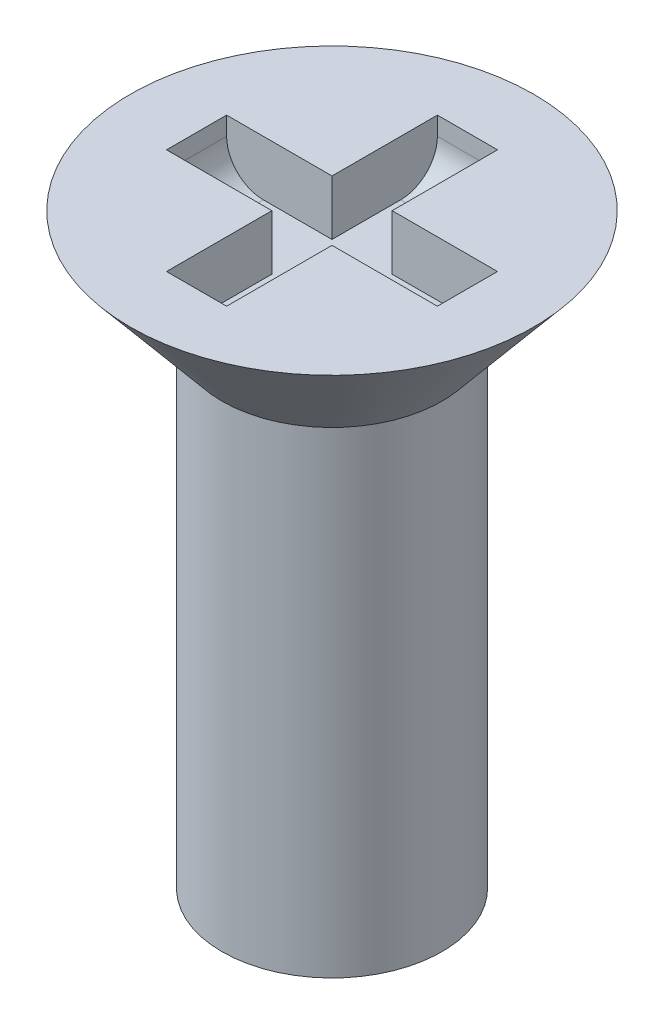
from build123d import *

# Parameters (mm, degrees)
SKETCH1_R           = 3
BOSS_EXTRUDE1_DEPTH = 13
CUT_EXTRUDE1_DEPTH  = 1.5
FILLET1_R           = 1
FILLET2_R           = 1
FILLET3_R           = 1
FILLET4_R           = 1


with BuildPart() as part:
    # Sketch1 → Boss-Extrude1 (new body)
    with BuildSketch(Plane(origin=(0, 0, 0), x_dir=(1, 0, 0), z_dir=(0, 1, 0))):
        with Locations(Location((0, 0, 0), (0, 0, 90))):
            Circle(SKETCH1_R)
    extrude(amount=BOSS_EXTRUDE1_DEPTH)

    # Sketch3 → Revolve2 (revolve)
    with BuildSketch(Plane.XY, mode=Mode.PRIVATE) as revolve2_sk:
        Polygon((0, 13), (0, 16), (-5.5, 16), (-3, 13), align=None)
    revolve(revolve2_sk.sketch.rotate(Axis((0, 13, 0), (0, 1, 0)), 270), axis=Axis((0, 13, 0), (0, 1, 0)))

    # Sketch4 → Cut-Extrude1 (cut)
    with BuildSketch(Plane(origin=(0, 16, 0), x_dir=(1, 0, 0), z_dir=(0, 1, 0))):
        Polygon((-0.819580165, 0.819580165), (-3.693115778, 0.819580165), (-3.693115778, -0.819580165), (-0.819580165, -0.819580165), (-0.819580165, -3.693115778), (0.819580165, -3.693115778), (0.819580165, -0.819580165), (3.693115778, -0.819580165), (3.693115778, 0.819580165), (0.819580165, 0.819580165), (0.819580165, 3.693115778), (-0.819580165, 3.693115778), align=None)
    extrude(amount=-CUT_EXTRUDE1_DEPTH, mode=Mode.SUBTRACT)

    # Fillet1
    fillet1_edges = [part.edges().sort_by_distance(p)[0] for p in [
        (0, 14.5, -3.693115778),
    ]]
    fillet(fillet1_edges, radius=FILLET1_R)

    # Fillet2
    fillet2_edges = [part.edges().sort_by_distance(p)[0] for p in [
        (3.693115778, 14.5, 0),
    ]]
    fillet(fillet2_edges, radius=FILLET2_R)

    # Fillet3
    fillet3_edges = [part.edges().sort_by_distance(p)[0] for p in [
        (0, 14.5, 3.693115778),
    ]]
    fillet(fillet3_edges, radius=FILLET3_R)

    # Fillet4
    fillet4_edges = [part.edges().sort_by_distance(p)[0] for p in [
        (-3.693115778, 14.5, 0),
    ]]
    fillet(fillet4_edges, radius=FILLET4_R)


solid = part.part
